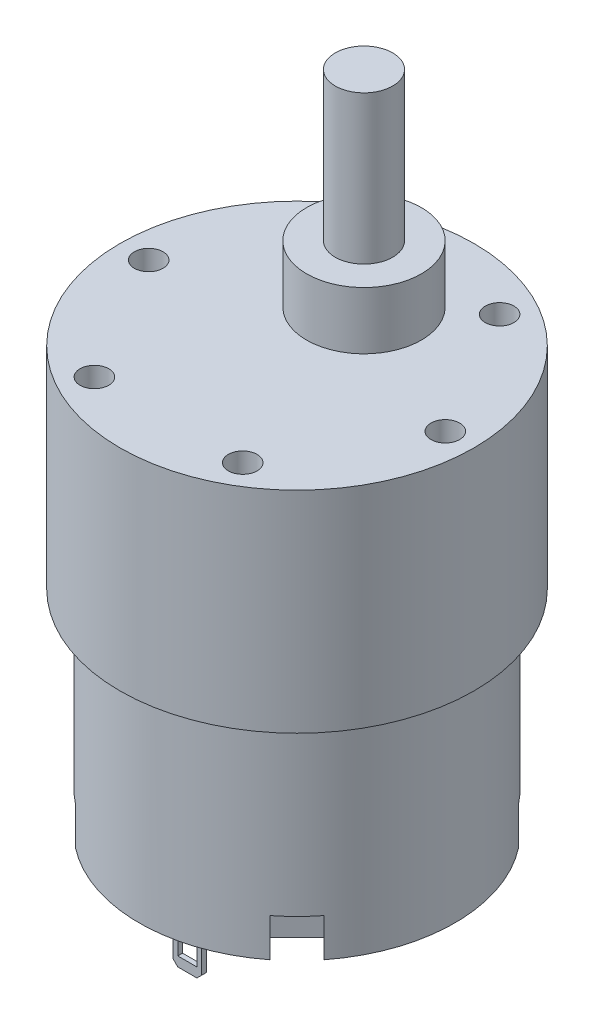
from build123d import *

# Parameters (mm, degrees)
SKETCH_1_R          = 16.5
EXTRUDE_1_DEPTH     = 22
SKETCH_2_R          = 18.5
EXTRUDE_2_DEPTH     = 22
SKETCH_3_R          = 6
EXTRUDE_3_DEPTH     = 6
SKETCH_4_R          = 3
EXTRUDE_7_DEPTH     = 15.5
CUT_EXTRUDE_1_DEPTH = 4
SKETCH_6_R          = 4
EXTRUDE_5_DEPTH     = 3
SKETCH_7_R          = 1.5
CUT_EXTRUDE_2_DEPTH = 6
SKETCH_8_W          = 3
SKETCH_8_H          = 0.5
EXTRUDE_6_DEPTH     = 7
SKETCH_9_W          = 2
SKETCH_9_H          = 3
CUT_EXTRUDE_3_DEPTH = 1
SKETCH_10_W         = 2
SKETCH_10_H         = 3
CUT_EXTRUDE_4_DEPTH = 1


with BuildPart() as part:
    # 草图1 → 凸台-拉伸1 (new body)
    with BuildSketch(Plane(origin=(0, 0, 0), x_dir=(1, 0, 0), z_dir=(0, 1, 0))):
        with Locations(Location((0, 0, 0), (0, 0, 270))):
            Circle(SKETCH_1_R)
    extrude(amount=EXTRUDE_1_DEPTH)

    # 草图2 → 凸台-拉伸2 (add)
    with BuildSketch(Plane(origin=(0, 22, 0), x_dir=(1, 0, 0), z_dir=(0, 1, 0))):
        with Locations(Location((0, 0, 0), (0, 0, 270))):
            Circle(SKETCH_2_R)
    extrude(amount=EXTRUDE_2_DEPTH)

    # 草图3 → 凸台-拉伸3 (add)
    with BuildSketch(Plane(origin=(0, 44, 0), x_dir=(1, 0, 0), z_dir=(0, 1, 0))):
        with Locations(Location((0, 7, 0), (0, 0, 270))):
            Circle(SKETCH_3_R)
    extrude(amount=EXTRUDE_3_DEPTH)

    # 草图4 → 凸台-拉伸7 (add)
    with BuildSketch(Plane(origin=(0, 50, 0), x_dir=(1, 0, 0), z_dir=(0, 1, 0))):
        with Locations(Location((0, 7, 0), (0, 0, 270))):
            Circle(SKETCH_4_R)
    extrude(amount=EXTRUDE_7_DEPTH)

    # 草图5 → 切除-拉伸1 (cut)
    with BuildSketch(Plane.XZ):
        with BuildLine():
            Line((-10.960155108, 8.131727984), (-8.131727984, 10.960155108))
            Line((-8.131727984, 10.960155108), (-10.16702126, 12.995448384))
            ThreePointArc((-10.16702126, 12.995448384), (-11.66726189, 11.66726189), (-12.995448384, 10.16702126))
            Line((-12.995448384, 10.16702126), (-10.960155108, 8.131727984))
        make_face()
        with BuildLine():
            Line((8.131727984, 10.960155108), (10.960155108, 8.131727984))
            Line((10.960155108, 8.131727984), (12.995448384, 10.16702126))
            ThreePointArc((12.995448384, 10.16702126), (11.66726189, 11.66726189), (10.16702126, 12.995448384))
            Line((10.16702126, 12.995448384), (8.131727984, 10.960155108))
        make_face()
        with BuildLine():
            Line((10.960155108, -8.131727984), (8.131727984, -10.960155108))
            Line((8.131727984, -10.960155108), (10.16702126, -12.995448384))
            ThreePointArc((10.16702126, -12.995448384), (11.66726189, -11.66726189), (12.995448384, -10.16702126))
            Line((12.995448384, -10.16702126), (10.960155108, -8.131727984))
        make_face()
        with BuildLine():
            Line((-8.131727984, -10.960155108), (-10.960155108, -8.131727984))
            Line((-10.960155108, -8.131727984), (-12.995448384, -10.16702126))
            ThreePointArc((-12.995448384, -10.16702126), (-11.66726189, -11.66726189), (-10.16702126, -12.995448384))
            Line((-10.16702126, -12.995448384), (-8.131727984, -10.960155108))
        make_face()
    extrude(amount=-CUT_EXTRUDE_1_DEPTH, mode=Mode.SUBTRACT)

    # 草图6 → 凸台-拉伸5 (add)
    with BuildSketch(Plane.XZ):
        with Locations(Location((0, 0, 0), (0, 0, 90))):
            Circle(SKETCH_6_R)
    extrude(amount=EXTRUDE_5_DEPTH)

    # 草图7 → 切除-拉伸2 (cut)
    with BuildSketch(Plane(origin=(0, 44, 0), x_dir=(1, 0, 0), z_dir=(0, 1, 0))):
        with Locations(Location((15.5, 0, 0), (0, 0, 270))):
            Circle(SKETCH_7_R)
        with Locations(Location((7.75, -13.423393759, 0), (0, 0, 270))):
            Circle(SKETCH_7_R)
        with Locations(Location((-7.75, -13.423393759, 0), (0, 0, 270))):
            Circle(SKETCH_7_R)
        with Locations(Location((-15.5, 0, 0), (0, 0, 270))):
            Circle(SKETCH_7_R)
        with Locations(Location((-7.75, 13.423393759, 0), (0, 0, 270))):
            Circle(SKETCH_7_R)
        with Locations(Location((7.75, 13.423393759, 0), (0, 0, 270))):
            Circle(SKETCH_7_R)
    extrude(amount=-CUT_EXTRUDE_2_DEPTH, mode=Mode.SUBTRACT)

    # 草图8 → 凸台-拉伸6 (add)
    with BuildSketch(Plane.XZ):
        with Locations((0, 11.210155108)):
            Rectangle(SKETCH_8_W, SKETCH_8_H)
        with Locations((0, -11.210155108)):
            Rectangle(SKETCH_8_W, SKETCH_8_H)
    extrude(amount=EXTRUDE_6_DEPTH)

    # 草图9 → 切除-拉伸3 (cut)
    with BuildSketch(Plane.XY.offset(11.460155108)):
        Polygon((1.5, -7), (1, -7), (1.5, -6.5), align=None)
        Polygon((-1.5, -7), (-1, -7), (-1.5, -6.5), align=None)
        with Locations((0, -4.5)):
            Rectangle(SKETCH_9_W, SKETCH_9_H)
    extrude(amount=-CUT_EXTRUDE_3_DEPTH, mode=Mode.SUBTRACT)

    # 草图10 → 切除-拉伸4 (cut)
    with BuildSketch(Plane(origin=(0, 0, -11.460155108), x_dir=(-1, 0, 0), z_dir=(0, 0, -1))):
        Polygon((1.5, -7), (1, -7), (1.5, -6.5), align=None)
        Polygon((-1.5, -7), (-1, -7), (-1.5, -6.5), align=None)
        with Locations((0, -4.5)):
            Rectangle(SKETCH_10_W, SKETCH_10_H)
    extrude(amount=-CUT_EXTRUDE_4_DEPTH, mode=Mode.SUBTRACT)


solid = part.part
